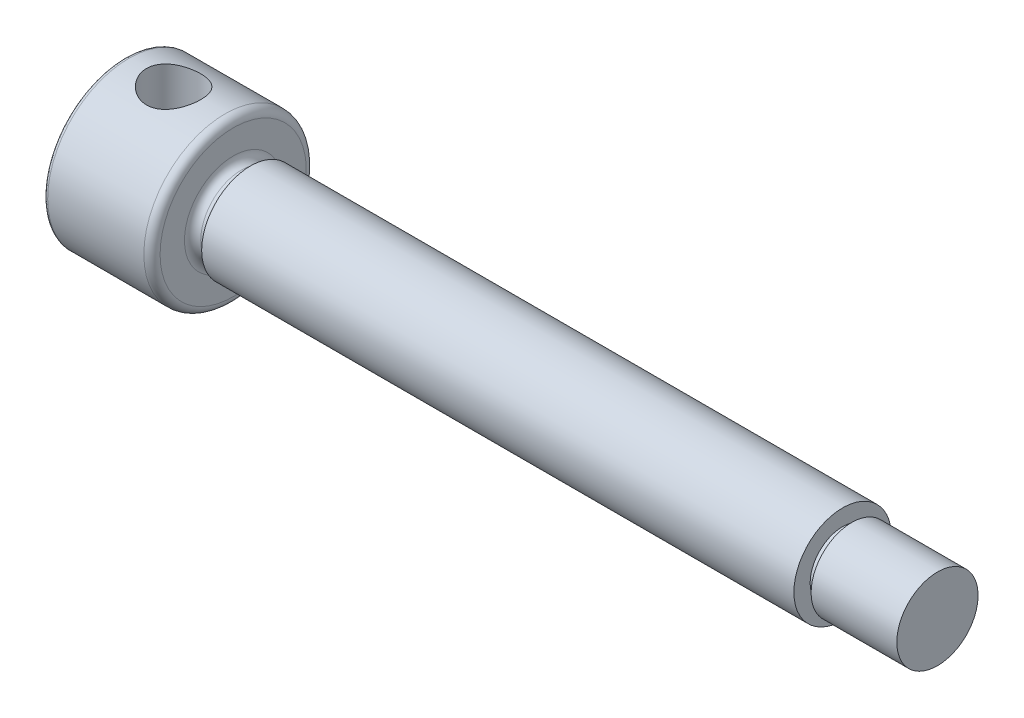
from build123d import *

# Parameters (mm, degrees)
FILLET1_R               = 1.5
CUT_EXTRUDE1_DEPTH      = 303.985148161
CUT_EXTRUDE1_DEPTH_BACK = 303.985148161
SKETCH2_R               = 10
FILLET2_R               = 3


with BuildPart() as part:
    # Sketch1 → Revolve1 (revolve)
    with BuildSketch(Plane.XY, mode=Mode.PRIVATE) as revolve1_sk:
        Polygon((0, 0), (0, 30), (40, 30), (40, 15), (46.35, 15), (46.35, 18), (265, 18), (265, 12), (268.35, 12), (268.35, 15), (300, 15), (300, 0), align=None)
    revolve(revolve1_sk.sketch.rotate(Axis((0, 0, 0), (1, 0, 0)), 90), axis=Axis((0, 0, 0), (1, 0, 0)))

    # Fillet1
    fillet1_edges = [part.edges().sort_by_distance(p)[0] for p in [
        (0, 0, -30),
    ]]
    fillet(fillet1_edges, radius=FILLET1_R)

    # Sketch2 → Cut-Extrude1 (cut, two sides: drawn at the far end of the back side and taken through both)
    with BuildSketch(Plane(origin=(0, 0, 0), x_dir=(1, 0, 0), z_dir=(0, 1, 0)).offset(-CUT_EXTRUDE1_DEPTH_BACK)):
        with Locations(Location((18, 0, 0), (0, 0, 270))):
            Circle(SKETCH2_R)
    extrude(amount=CUT_EXTRUDE1_DEPTH + CUT_EXTRUDE1_DEPTH_BACK, mode=Mode.SUBTRACT)

    # Fillet2
    fillet2_edges = [part.edges().sort_by_distance(p)[0] for p in [
        (40, 0, -15),
        (40, 0, -30),
    ]]
    fillet(fillet2_edges, radius=FILLET2_R)


solid = part.part
